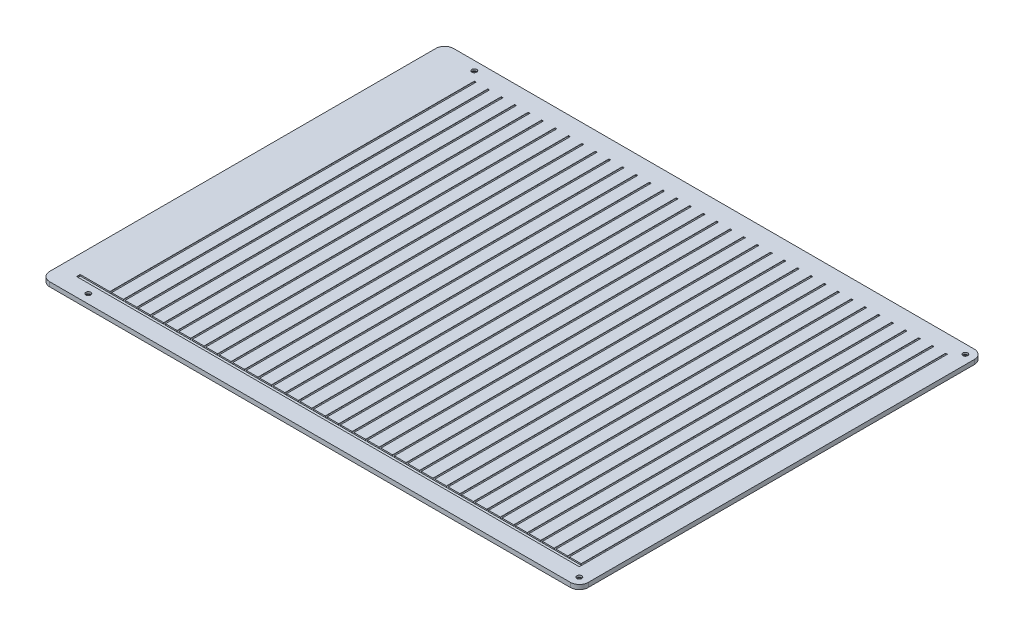
from build123d import *

# Parameters (mm, degrees)
SKETCH1_W                    = 600
SKETCH1_H                    = 450
BOSS_EXTRUDE1_DEPTH          = 5
CUT_EXTRUDE1_START           = -20
CUT_EXTRUDE1_DEPTH           = 410
SKETCH3_W                    = 4
SKETCH3_H                    = 1.5
CUT_EXTRUDE2_DEPTH           = 560
FILLET2_R                    = 10
CSK_FOR_M5_SFHCS4_AT_2_COUNT = 2
CSK_FOR_M5_SFHCS4_AT_2_PITCH = 430
CSK_FOR_M5_SFHCS4_AT_3_COUNT = 2
CSK_FOR_M5_SFHCS4_AT_3_PITCH = 695.779419069
CSK_FOR_M5_SFHCS4_AT_4_COUNT = 2
CSK_FOR_M5_SFHCS4_AT_4_PITCH = 547


with BuildPart() as part:
    # Sketch1 → Boss-Extrude1 (new body)
    with BuildSketch(Plane(origin=(0, 0, 0), x_dir=(1, 0, 0), z_dir=(0, 1, 0))):
        Rectangle(SKETCH1_W, SKETCH1_H)
    extrude(amount=BOSS_EXTRUDE1_DEPTH)

    # Sketch2 → Cut-Extrude1 (cut)
    with BuildSketch(Plane.XY.offset(225).offset(CUT_EXTRUDE1_START)):
        with BuildLine():
            Line((280, 4.5), (280, 5))
            Line((280, 5), (278, 5))
            Line((278, 5), (278, 4.5))
            ThreePointArc((278, 4.5), (279, 3.5), (280, 4.5))
        make_face()
        with BuildLine():
            Line((263, 5), (263, 4.5))
            ThreePointArc((263, 4.5), (264, 3.5), (265, 4.5))
            Line((265, 4.5), (265, 5))
            Line((265, 5), (263, 5))
        make_face()
        with BuildLine():
            Line((248, 5), (248, 4.5))
            ThreePointArc((248, 4.5), (249, 3.5), (250, 4.5))
            Line((250, 4.5), (250, 5))
            Line((250, 5), (248, 5))
        make_face()
        with BuildLine():
            Line((233, 5), (233, 4.5))
            ThreePointArc((233, 4.5), (234, 3.5), (235, 4.5))
            Line((235, 4.5), (235, 5))
            Line((235, 5), (233, 5))
        make_face()
        with BuildLine():
            Line((218, 5), (218, 4.5))
            ThreePointArc((218, 4.5), (219, 3.5), (220, 4.5))
            Line((220, 4.5), (220, 5))
            Line((220, 5), (218, 5))
        make_face()
        with BuildLine():
            Line((203, 5), (203, 4.5))
            ThreePointArc((203, 4.5), (204, 3.5), (205, 4.5))
            Line((205, 4.5), (205, 5))
            Line((205, 5), (203, 5))
        make_face()
        with BuildLine():
            Line((188, 5), (188, 4.5))
            ThreePointArc((188, 4.5), (189, 3.5), (190, 4.5))
            Line((190, 4.5), (190, 5))
            Line((190, 5), (188, 5))
        make_face()
        with BuildLine():
            Line((173, 5), (173, 4.5))
            ThreePointArc((173, 4.5), (174, 3.5), (175, 4.5))
            Line((175, 4.5), (175, 5))
            Line((175, 5), (173, 5))
        make_face()
        with BuildLine():
            Line((158, 5), (158, 4.5))
            ThreePointArc((158, 4.5), (159, 3.5), (160, 4.5))
            Line((160, 4.5), (160, 5))
            Line((160, 5), (158, 5))
        make_face()
        with BuildLine():
            Line((143, 5), (143, 4.5))
            ThreePointArc((143, 4.5), (144, 3.5), (145, 4.5))
            Line((145, 4.5), (145, 5))
            Line((145, 5), (143, 5))
        make_face()
        with BuildLine():
            Line((128, 5), (128, 4.5))
            ThreePointArc((128, 4.5), (129, 3.5), (130, 4.5))
            Line((130, 4.5), (130, 5))
            Line((130, 5), (128, 5))
        make_face()
        with BuildLine():
            Line((113, 5), (113, 4.5))
            ThreePointArc((113, 4.5), (114, 3.5), (115, 4.5))
            Line((115, 4.5), (115, 5))
            Line((115, 5), (113, 5))
        make_face()
        with BuildLine():
            Line((98, 5), (98, 4.5))
            ThreePointArc((98, 4.5), (99, 3.5), (100, 4.5))
            Line((100, 4.5), (100, 5))
            Line((100, 5), (98, 5))
        make_face()
        with BuildLine():
            Line((83, 5), (83, 4.5))
            ThreePointArc((83, 4.5), (84, 3.5), (85, 4.5))
            Line((85, 4.5), (85, 5))
            Line((85, 5), (83, 5))
        make_face()
        with BuildLine():
            Line((68, 5), (68, 4.5))
            ThreePointArc((68, 4.5), (69, 3.5), (70, 4.5))
            Line((70, 4.5), (70, 5))
            Line((70, 5), (68, 5))
        make_face()
        with BuildLine():
            Line((53, 5), (53, 4.5))
            ThreePointArc((53, 4.5), (54, 3.5), (55, 4.5))
            Line((55, 4.5), (55, 5))
            Line((55, 5), (53, 5))
        make_face()
        with BuildLine():
            Line((38, 5), (38, 4.5))
            ThreePointArc((38, 4.5), (39, 3.5), (40, 4.5))
            Line((40, 4.5), (40, 5))
            Line((40, 5), (38, 5))
        make_face()
        with BuildLine():
            Line((23, 5), (23, 4.5))
            ThreePointArc((23, 4.5), (24, 3.5), (25, 4.5))
            Line((25, 4.5), (25, 5))
            Line((25, 5), (23, 5))
        make_face()
        with BuildLine():
            Line((8, 5), (8, 4.5))
            ThreePointArc((8, 4.5), (9, 3.5), (10, 4.5))
            Line((10, 4.5), (10, 5))
            Line((10, 5), (8, 5))
        make_face()
        with BuildLine():
            Line((-7, 5), (-7, 4.5))
            ThreePointArc((-7, 4.5), (-6, 3.5), (-5, 4.5))
            Line((-5, 4.5), (-5, 5))
            Line((-5, 5), (-7, 5))
        make_face()
        with BuildLine():
            Line((-22, 5), (-22, 4.5))
            ThreePointArc((-22, 4.5), (-21, 3.5), (-20, 4.5))
            Line((-20, 4.5), (-20, 5))
            Line((-20, 5), (-22, 5))
        make_face()
        with BuildLine():
            Line((-37, 5), (-37, 4.5))
            ThreePointArc((-37, 4.5), (-36, 3.5), (-35, 4.5))
            Line((-35, 4.5), (-35, 5))
            Line((-35, 5), (-37, 5))
        make_face()
        with BuildLine():
            Line((-52, 5), (-52, 4.5))
            ThreePointArc((-52, 4.5), (-51, 3.5), (-50, 4.5))
            Line((-50, 4.5), (-50, 5))
            Line((-50, 5), (-52, 5))
        make_face()
        with BuildLine():
            Line((-67, 5), (-67, 4.5))
            ThreePointArc((-67, 4.5), (-66, 3.5), (-65, 4.5))
            Line((-65, 4.5), (-65, 5))
            Line((-65, 5), (-67, 5))
        make_face()
        with BuildLine():
            Line((-82, 5), (-82, 4.5))
            ThreePointArc((-82, 4.5), (-81, 3.5), (-80, 4.5))
            Line((-80, 4.5), (-80, 5))
            Line((-80, 5), (-82, 5))
        make_face()
        with BuildLine():
            Line((-97, 5), (-97, 4.5))
            ThreePointArc((-97, 4.5), (-96, 3.5), (-95, 4.5))
            Line((-95, 4.5), (-95, 5))
            Line((-95, 5), (-97, 5))
        make_face()
        with BuildLine():
            Line((-112, 5), (-112, 4.5))
            ThreePointArc((-112, 4.5), (-111, 3.5), (-110, 4.5))
            Line((-110, 4.5), (-110, 5))
            Line((-110, 5), (-112, 5))
        make_face()
        with BuildLine():
            Line((-127, 5), (-127, 4.5))
            ThreePointArc((-127, 4.5), (-126, 3.5), (-125, 4.5))
            Line((-125, 4.5), (-125, 5))
            Line((-125, 5), (-127, 5))
        make_face()
        with BuildLine():
            Line((-142, 5), (-142, 4.5))
            ThreePointArc((-142, 4.5), (-141, 3.5), (-140, 4.5))
            Line((-140, 4.5), (-140, 5))
            Line((-140, 5), (-142, 5))
        make_face()
        with BuildLine():
            Line((-157, 5), (-157, 4.5))
            ThreePointArc((-157, 4.5), (-156, 3.5), (-155, 4.5))
            Line((-155, 4.5), (-155, 5))
            Line((-155, 5), (-157, 5))
        make_face()
        with BuildLine():
            Line((-172, 5), (-172, 4.5))
            ThreePointArc((-172, 4.5), (-171, 3.5), (-170, 4.5))
            Line((-170, 4.5), (-170, 5))
            Line((-170, 5), (-172, 5))
        make_face()
        with BuildLine():
            Line((-187, 5), (-187, 4.5))
            ThreePointArc((-187, 4.5), (-186, 3.5), (-185, 4.5))
            Line((-185, 4.5), (-185, 5))
            Line((-185, 5), (-187, 5))
        make_face()
        with BuildLine():
            Line((-202, 5), (-202, 4.5))
            ThreePointArc((-202, 4.5), (-201, 3.5), (-200, 4.5))
            Line((-200, 4.5), (-200, 5))
            Line((-200, 5), (-202, 5))
        make_face()
        with BuildLine():
            Line((-217, 5), (-217, 4.5))
            ThreePointArc((-217, 4.5), (-216, 3.5), (-215, 4.5))
            Line((-215, 4.5), (-215, 5))
            Line((-215, 5), (-217, 5))
        make_face()
        with BuildLine():
            Line((-232, 5), (-232, 4.5))
            ThreePointArc((-232, 4.5), (-231, 3.5), (-230, 4.5))
            Line((-230, 4.5), (-230, 5))
            Line((-230, 5), (-232, 5))
        make_face()
        with BuildLine():
            Line((-247, 5), (-247, 4.5))
            ThreePointArc((-247, 4.5), (-246, 3.5), (-245, 4.5))
            Line((-245, 4.5), (-245, 5))
            Line((-245, 5), (-247, 5))
        make_face()
    extrude(amount=-CUT_EXTRUDE1_DEPTH, mode=Mode.SUBTRACT)

    # Sketch3 → Cut-Extrude2 (cut)
    with BuildSketch(Plane.ZY.offset(-280)):
        with Locations((203, 4.25)):
            Rectangle(SKETCH3_W, SKETCH3_H)
    extrude(amount=CUT_EXTRUDE2_DEPTH, mode=Mode.SUBTRACT)

    # Fillet2
    fillet2_edges = [part.edges().sort_by_distance(p)[0] for p in [
        (300, 2.5, 225),
        (-300, 2.5, 225),
        (-300, 2.5, -225),
        (300, 2.5, -225),
    ]]
    fillet(fillet2_edges, radius=FILLET2_R)

    # Sketch10 → CSK for M5 SFHCS4 (revolve, cut)
    with BuildSketch(Plane(origin=(-257, 0, 215), x_dir=(0, 0, -1), z_dir=(1, 0, 0))):
        Polygon((0, 0), (0, 5), (2.75, 5), (2.75, 2.85), (5.6, 0), align=None)
    csk_for_m5_sfhcs4 = revolve(axis=Axis((-257, -6.35, 215), (0, 1, 0)), mode=Mode.SUBTRACT)

    # CSK for M5 SFHCS4 at 2: CSK for M5 SFHCS4 ×2
    with Locations(*[(0, 0, -i * CSK_FOR_M5_SFHCS4_AT_2_PITCH) for i in range(1, CSK_FOR_M5_SFHCS4_AT_2_COUNT)]):
        add(csk_for_m5_sfhcs4, mode=Mode.SUBTRACT)

    # CSK for M5 SFHCS4 at 3: CSK for M5 SFHCS4 ×2
    with Locations(*[Vector(0.7861686980220258, 0, -0.6180119563975708) * (i * CSK_FOR_M5_SFHCS4_AT_3_PITCH) for i in range(1, CSK_FOR_M5_SFHCS4_AT_3_COUNT)]):
        add(csk_for_m5_sfhcs4, mode=Mode.SUBTRACT)

    # CSK for M5 SFHCS4 at 4: CSK for M5 SFHCS4 ×2
    with Locations(*[(i * CSK_FOR_M5_SFHCS4_AT_4_PITCH, 0, 0) for i in range(1, CSK_FOR_M5_SFHCS4_AT_4_COUNT)]):
        add(csk_for_m5_sfhcs4, mode=Mode.SUBTRACT)


solid = part.part
